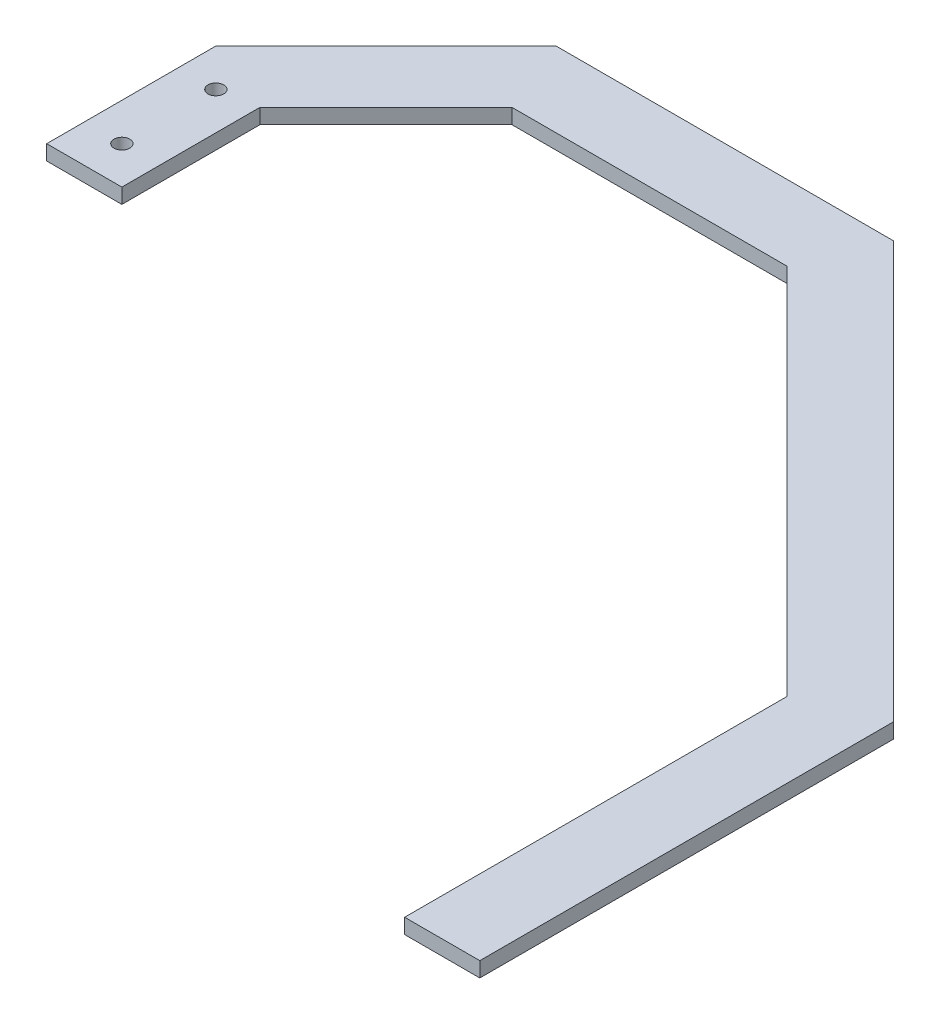
from build123d import *

# Parameters (mm, degrees)
SKETCH_1_R      = 2.1
EXTRUDE_1_DEPTH = 4


with BuildPart() as part:
    # 草图1 → 凸台-拉伸1 (new body)
    with BuildSketch(Plane(origin=(0, 0, 0), x_dir=(1, 0, 0), z_dir=(0, 1, 0))):
        Polygon((20, 0), (0, 0), (0, 45), (45.25, 90.25), (134.96758269, 90.25), (245.824430246, -20.606847556), (245.824430246, -130.606847556), (225.824430246, -130.606847556), (225.824430246, -28.891118804), (126.683311442, 70.25), (53.534271247, 70.25), (20, 36.715728753), align=None)
        with Locations(Location((10, 10, 0), (0, 0, 270))):
            Circle(SKETCH_1_R, mode=Mode.SUBTRACT)
        with Locations(Location((10, 35, 0), (0, 0, 90))):
            Circle(SKETCH_1_R, mode=Mode.SUBTRACT)
    extrude(amount=EXTRUDE_1_DEPTH)


solid = part.part
